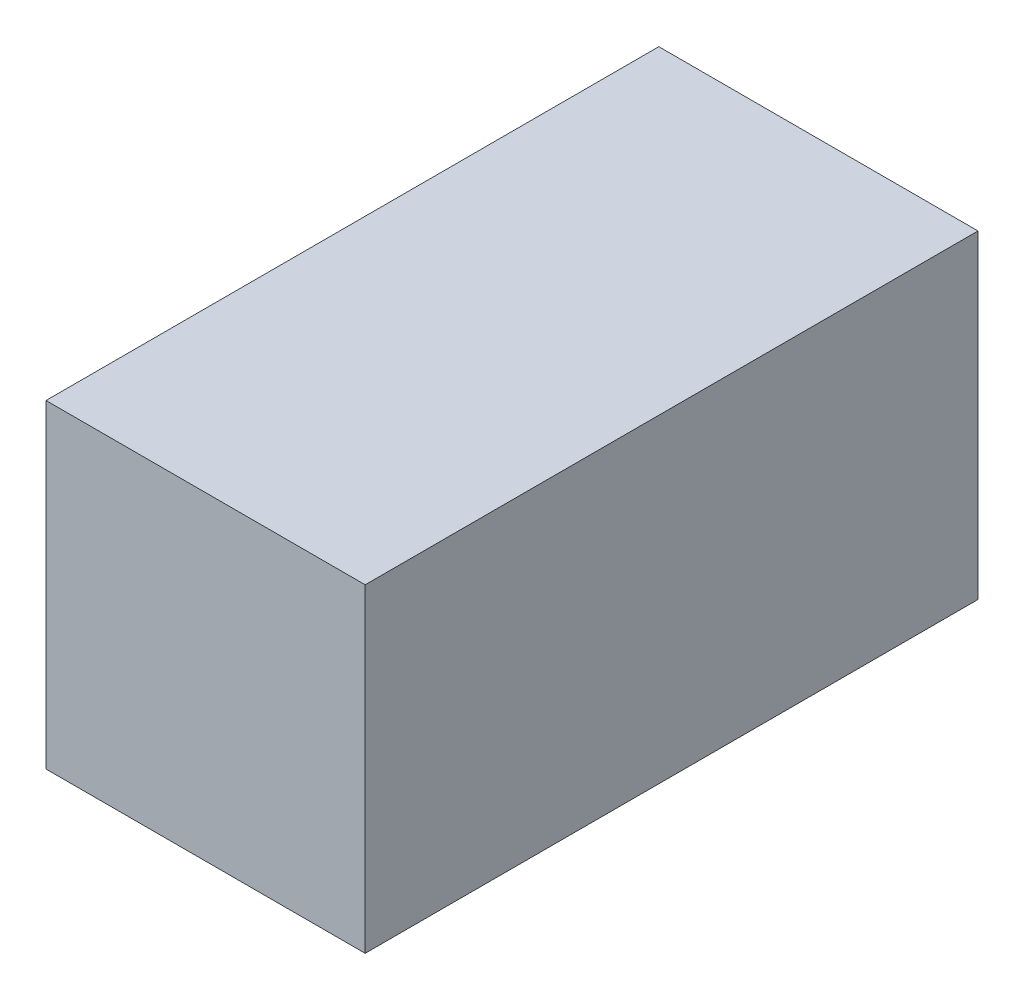
from build123d import *

# Parameters (mm, degrees)
SKETCH1_W      = 2.38125
SKETCH1_H      = 2.38125
EXTRUDE1_DEPTH = 4.572


with BuildPart() as part:
    # Sketch1 → Extrude1 (new body)
    with BuildSketch(Plane.XY):
        Rectangle(SKETCH1_W, SKETCH1_H)
    extrude(amount=-EXTRUDE1_DEPTH)


solid = part.part
